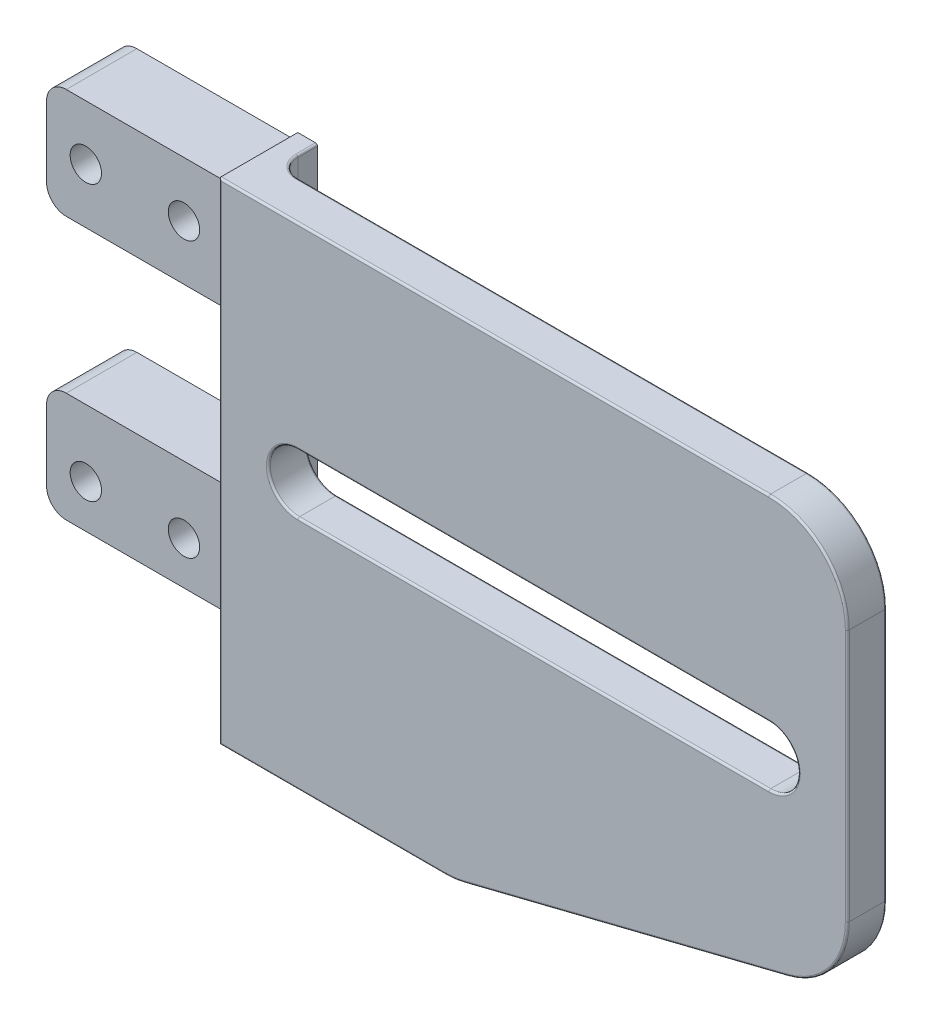
from build123d import *

# Parameters (mm, degrees)
BOSS_EXTRUDE1_DEPTH      = 5
BOSS_EXTRUDE3_DEPTH      = 4
BOSS_EXTRUDE3_DEPTH_BACK = 14
SKETCH1_3_W              = 45
SKETCH1_3_H              = 28
SKETCH1_3_R              = 4
FILLET1_R                = 20
SKETCH2_W                = 5
SKETCH2_H                = 125
BOSS_EXTRUDE4_DEPTH      = 10
FILLET2_R                = 5
FILLET4_R                = 0.5


with BuildPart() as part:
    # Sketch1 → Boss-Extrude1 (new, symmetric)
    with BuildSketch(Plane.XY):
        Polygon((80, -37.5), (80, 62.5), (-80, 62.5), (-80, -62.5), (-20, -62.5), align=None)
        with BuildLine():
            ThreePointArc((-60, 12.5), (-67.5, 5), (-60, -2.5))
            Line((-60, -2.5), (60, -2.5))
            ThreePointArc((60, -2.5), (67.5, 5), (60, 12.5))
            Line((60, 12.5), (-60, 12.5))
        make_face(mode=Mode.SUBTRACT)
    extrude(amount=BOSS_EXTRUDE1_DEPTH, both=True)

    # Sketch1<3> → Boss-Extrude3 (add, two sides: drawn at the far end of the back side and taken through both)
    # profile 1 of 2: a face of its own
    with BuildSketch(Plane.XY.offset(-BOSS_EXTRUDE3_DEPTH_BACK)):
        with Locations((-102.5, 47.5)):
            Rectangle(SKETCH1_3_W, SKETCH1_3_H)
        with Locations((-115, 47.5)):
            Circle(SKETCH1_3_R, mode=Mode.SUBTRACT)
        with Locations((-90, 47.5)):
            Circle(SKETCH1_3_R, mode=Mode.SUBTRACT)
    # profile 2 of 2: a face of its own
    with BuildSketch(Plane.XY.offset(-BOSS_EXTRUDE3_DEPTH_BACK)):
        with Locations((-102.5, -19.5)):
            Rectangle(SKETCH1_3_W, SKETCH1_3_H)
        with Locations((-115, -22.5)):
            Circle(SKETCH1_3_R, mode=Mode.SUBTRACT)
        with Locations((-90, -22.5)):
            Circle(SKETCH1_3_R, mode=Mode.SUBTRACT)
    extrude(amount=BOSS_EXTRUDE3_DEPTH + BOSS_EXTRUDE3_DEPTH_BACK)

    # Fillet1
    fillet1_edges = [part.edges().sort_by_distance(p)[0] for p in [
        (80, -37.5, 0),
        (-20, -62.5, 0),
        (80, 62.5, 0),
    ]]
    fillet(fillet1_edges, radius=FILLET1_R)

    # Sketch2 → Boss-Extrude4 (add)
    with BuildSketch(Plane(origin=(0, 0, -5), x_dir=(-1, 0, 0), z_dir=(0, 0, -1))):
        with Locations((77.5, 0)):
            Rectangle(SKETCH2_W, SKETCH2_H)
    extrude(amount=BOSS_EXTRUDE4_DEPTH)

    # Fillet2
    fillet2_edges = [part.edges().sort_by_distance(p)[0] for p in [
        (-125, 33.5, -5),
        (-125, 61.5, -5),
        (-125, -5.5, -5),
        (-125, -33.5, -5),
        (-75, 0, -5),
    ]]
    fillet(fillet2_edges, radius=FILLET2_R)

    # Fillet4
    fillet4_edges = [part.edges().sort_by_distance(p)[0] for p in [
        (0, 12.5, 5),
        (-46.231056256, -62.5, -5),
        (-73.535533906, -62.5, -6.464466094),
        (-73.535533906, 62.5, -6.464466094),
        (0, -2.5, -5),
        (67.5, 5, -5),
        (0, 12.5, -5),
        (67.5, 5, 5),
        (-67.5, 5, -5),
        (0, -2.5, 5),
        (-80, 0, 5),
        (-51.231056256, -62.5, 5),
        (-67.5, 5, 5),
        (23.619656245, -51.595085939, -5),
        (23.619656245, -51.595085939, 5),
        (80, 10.307764064, -5),
        (-5, 62.5, -5),
        (74.142135624, 56.642135624, -5),
        (75.76410876, -34.19271606, -5),
        (-20.018447238, -62.350151134, -5),
        (80, 10.307764064, 5),
        (-10, 62.5, 5),
        (74.142135624, 56.642135624, 5),
        (75.76410876, -34.19271606, 5),
        (-20.018447238, -62.350151134, 5),
        (-75, 62.5, -12.5),
        (-75, -62.5, -12.5),
    ]]
    fillet(fillet4_edges, radius=FILLET4_R)


solid = part.part
